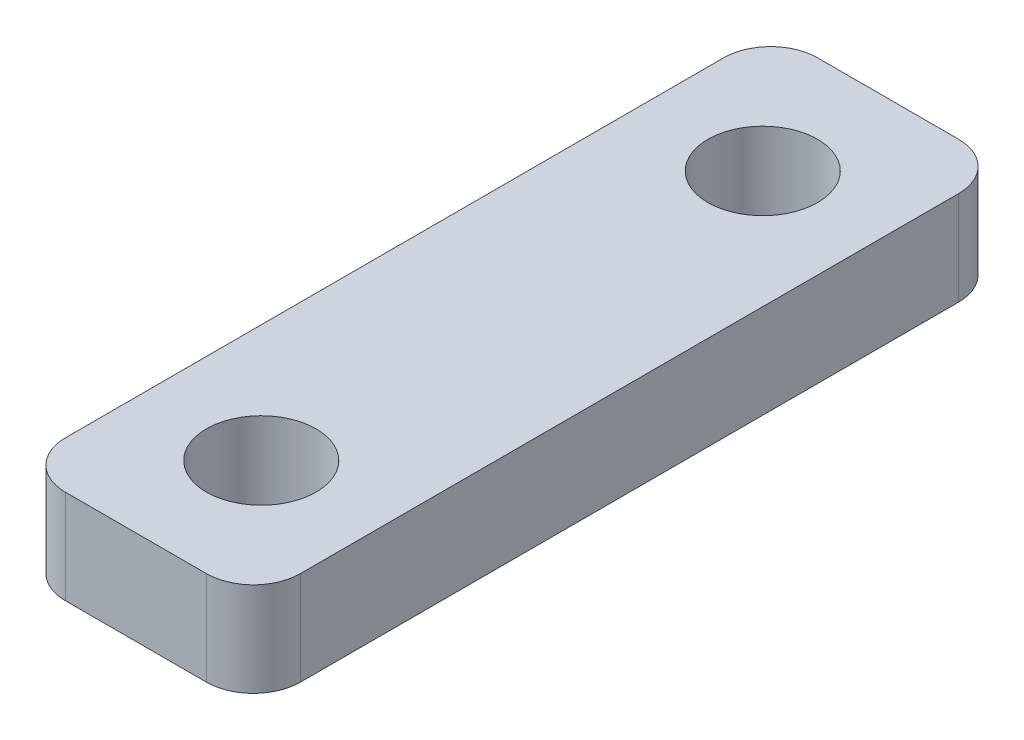
from build123d import *

# Parameters (mm, degrees)
SKETCH1_R           = 3.5
BOSS_EXTRUDE1_DEPTH = 6


with BuildPart() as part:
    # Sketch1 → Boss-Extrude1 (new body)
    with BuildSketch(Plane(origin=(0, 0, 0), x_dir=(1, 0, 0), z_dir=(0, 1, 0))):
        with BuildLine():
            Line((0, 0), (0, 42))
            ThreePointArc((0, 42), (0.878679656, 44.121320344), (3, 45))
            Line((3, 45), (12, 45))
            ThreePointArc((12, 45), (14.121320344, 44.121320344), (15, 42))
            Line((15, 42), (15, 0))
            ThreePointArc((15, 0), (14.121320344, -2.121320344), (12, -3))
            Line((12, -3), (3, -3))
            ThreePointArc((3, -3), (0.878679656, -2.121320344), (0, 0))
        make_face()
        with Locations(Location((7.5, 37, 0), (0, 0, 270))):
            Circle(SKETCH1_R, mode=Mode.SUBTRACT)
        with Locations(Location((7.5, 5, 0), (0, 0, 270))):
            Circle(SKETCH1_R, mode=Mode.SUBTRACT)
    extrude(amount=BOSS_EXTRUDE1_DEPTH)


solid = part.part
